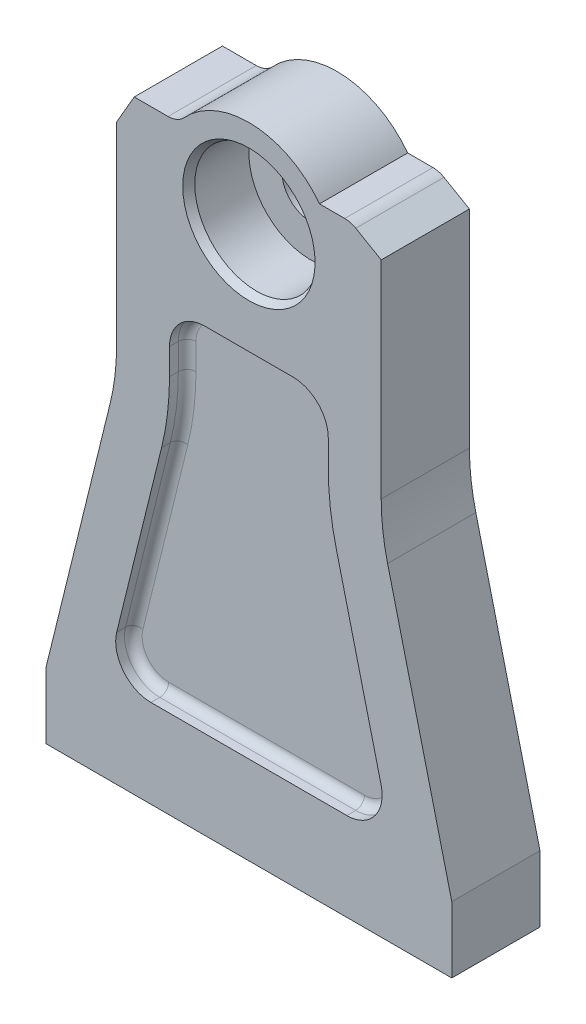
from build123d import *
from OCP.BRepFilletAPI import BRepFilletAPI_MakeChamfer

# Parameters (mm, degrees)
SKETCH1_R                   = 6.5
BOSS_EXTRUDE1_DEPTH         = 10
SKETCH2_R                   = 14
CUT_EXTRUDE1_DEPTH          = 14
CHAMFER1_SIZE               = 1
CHAMFER1_SIZE2              = 1.732050808
CHAMFER2_SIZE               = 4
CHAMFER2_SIZE2              = 6.92820323
FILLET1_R                   = 5
CUT_EXTRUDE2_DEPTH          = 4
FILLET2_R                   = 2
FILLET2_OF_MIRROR1_R        = 2
M10X1_25_TAPPED_HOLE1_D     = 8.8
M10X1_25_TAPPED_HOLE1_DEPTH = 20
M10X1_25_TAPPED_HOLE1_TIP   = 2.643786724


with BuildPart() as part:
    # Sketch1 → Boss-Extrude1 (new, symmetric)
    with BuildSketch(Plane.XY):
        with BuildLine():
            Line((-46, 0), (46, 0))
            Line((46, 0), (46, 15))
            Line((46, 15), (31.449256053, 74.112397284))
            ThreePointArc((31.449256053, 74.112397284), (30.363636327, 80.044097084), (30, 86.06334964))
            Line((30, 86.06334964), (30, 137))
            Line((30, 137), (16, 137))
            ThreePointArc((16, 137), (0, 145), (-16, 137))
            Line((-16, 137), (-30, 137))
            Line((-30, 137), (-30, 86.06334964))
            ThreePointArc((-30, 86.06334964), (-30.363636327, 80.044097084), (-31.449256053, 74.112397284))
            Line((-31.449256053, 74.112397284), (-46, 15))
            Line((-46, 15), (-46, 0))
        make_face()
        with Locations((0, 125)):
            Circle(SKETCH1_R, mode=Mode.SUBTRACT)
    extrude(amount=BOSS_EXTRUDE1_DEPTH, both=True)

    # Sketch2 → Cut-Extrude1 (cut)
    with BuildSketch(Plane.XY.offset(10)):
        with Locations((0, 125)):
            Circle(SKETCH2_R)
    extrude(amount=-CUT_EXTRUDE1_DEPTH, mode=Mode.SUBTRACT)

    # Chamfer1
    chamfer1_edges = [part.edges().sort_by_distance(p)[0] for p in [
        (-14, 125, 10),
    ]]
    chamfer1_side = [part.faces().sort_by_distance(p)[0] for p in [
        (0, 59.441099991, 10),
    ]]
    chamfer(chamfer1_edges, length=CHAMFER1_SIZE, length2=CHAMFER1_SIZE2, reference=chamfer1_side[0])

    # Chamfer2: one chamfer whose edges measure the first distance from different faces: ONE call of the kernel's chamfer builder (chamfer() names one face for all edges)
    chamfer2_edges_1 = [part.edges().sort_by_distance(p)[0] for p in [
        (-30, 137, 0),
    ]]
    chamfer2_side_1 = [part.faces().sort_by_distance(p)[0] for p in [
        (-23, 137, 0),
    ]]
    chamfer2_edges_2 = [part.edges().sort_by_distance(p)[0] for p in [
        (30, 137, 0),
    ]]
    chamfer2_side_2 = [part.faces().sort_by_distance(p)[0] for p in [
        (30, 111.53167482, 0),
    ]]
    chamfer2 = BRepFilletAPI_MakeChamfer(part.part.solid().wrapped)
    for e in chamfer2_edges_1:
        chamfer2.Add(CHAMFER2_SIZE, CHAMFER2_SIZE2, e.wrapped, chamfer2_side_1[0].wrapped)  # the first distance lies on this face
    for e in chamfer2_edges_2:
        chamfer2.Add(CHAMFER2_SIZE, CHAMFER2_SIZE2, e.wrapped, chamfer2_side_2[0].wrapped)  # the first distance lies on this face
    add(Compound.cast(chamfer2.Shape()), mode=Mode.REPLACE)

    # Fillet1
    fillet1_edges = [part.edges().sort_by_distance(p)[0] for p in [
        (-16, 137, 0),
        (23.07179677, 137, 0),
    ]]
    fillet(fillet1_edges, radius=FILLET1_R)

    # Sketch4 → Cut-Extrude2 (cut)
    with BuildSketch(Plane.XY.offset(10)):
        with BuildLine():
            ThreePointArc((-19.797077506, 71.244168718), (-18.450909046, 78.59947647), (-18, 86.06334964))
            Line((-18, 86.06334964), (-18, 92))
            ThreePointArc((-18, 92), (-15.656854249, 97.656854249), (-10, 100))
            Line((-10, 100), (10, 100))
            ThreePointArc((10, 100), (15.656854249, 97.656854249), (18, 92))
            Line((18, 92), (18, 86.06334964))
            ThreePointArc((18, 86.06334964), (18.450909046, 78.59947647), (19.797077506, 71.244168718))
            Line((19.797077506, 71.244168718), (29.971112298, 29.912152377))
            ThreePointArc((29.971112298, 29.912152377), (28.49970745, 23.065287193), (22.202993266, 20))
            Line((22.202993266, 20), (-22.202993266, 20))
            ThreePointArc((-22.202993266, 20), (-28.49970745, 23.065287193), (-29.971112298, 29.912152377))
            Line((-29.971112298, 29.912152377), (-19.797077506, 71.244168718))
        make_face()
    cut_extrude2 = extrude(amount=-CUT_EXTRUDE2_DEPTH, mode=Mode.SUBTRACT)

    # Fillet2
    fillet2_edges = [part.edges().sort_by_distance(p)[0] for p in [
        (-18, 89.03167482, 6),
        (-15.656854249, 97.656854249, 6),
        (18, 89.03167482, 6),
        (24.884094902, 50.578160548, 6),
        (28.49970745, 23.065287193, 6),
        (0, 20, 6),
        (-24.884094902, 50.578160548, 6),
        (-18.450909046, 78.59947647, 6),
        (0, 100, 6),
        (15.656854249, 97.656854249, 6),
        (18.450909046, 78.59947647, 6),
        (-28.49970745, 23.065287193, 6),
    ]]
    fillet(fillet2_edges, radius=FILLET2_R)

    # Mirror1: Cut-Extrude2 across plane
    add(cut_extrude2.mirror(Plane.XY), mode=Mode.SUBTRACT)

    # Fillet2 of Mirror1
    fillet2_of_mirror1_edges = [part.edges().sort_by_distance(p)[0] for p in [
        (-18, 89.03167482, -6),
        (-15.656854249, 97.656854249, -6),
        (18, 89.03167482, -6),
        (24.884094902, 50.578160548, -6),
        (28.49970745, 23.065287193, -6),
        (0, 20, -6),
        (-24.884094902, 50.578160548, -6),
        (-18.450909046, 78.59947647, -6),
        (0, 100, -6),
        (15.656854249, 97.656854249, -6),
        (18.450909046, 78.59947647, -6),
        (-28.49970745, 23.065287193, -6),
    ]]
    fillet(fillet2_of_mirror1_edges, radius=FILLET2_OF_MIRROR1_R)

    # M10x1.25 Tapped Hole1
    with Locations(Plane(origin=(0, 0, 0), x_dir=(-1, 0, 0), z_dir=(0, -1, 0))):
        with Locations((-30, 0), (30, 0)):
            Hole(M10X1_25_TAPPED_HOLE1_D / 2, depth=M10X1_25_TAPPED_HOLE1_DEPTH)
            with Locations((0, 0, -(M10X1_25_TAPPED_HOLE1_DEPTH + M10X1_25_TAPPED_HOLE1_TIP / 2))):  # 118° drill point
                Cone(0, M10X1_25_TAPPED_HOLE1_D / 2, M10X1_25_TAPPED_HOLE1_TIP, mode=Mode.SUBTRACT)


solid = part.part
